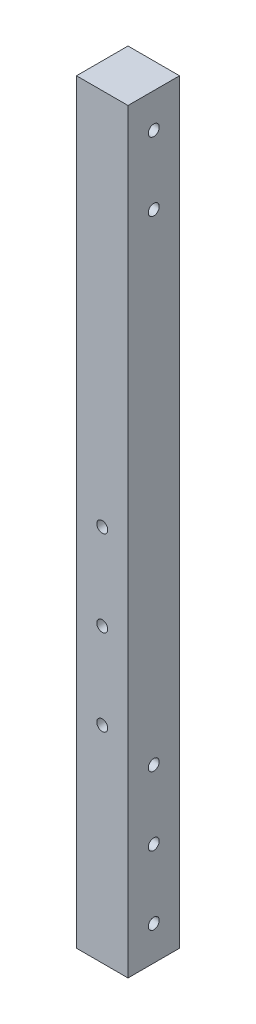
from build123d import *

# Parameters (mm, degrees)
SKETCH_1_W               = 15
SKETCH_1_H               = 15
EXTRUDE_1_DEPTH          = 220
SKETCH_2_R               = 1.6
CUT_EXTRUDE_1_DEPTH      = 222.020361053
CUT_EXTRUDE_2_DEPTH      = 222.020361053
CUT_EXTRUDE_2_DEPTH_BACK = 222.020361053
SKETCH_3_R               = 1.6


with BuildPart() as part:
    # 草图1 → 凸台-拉伸1 (new body)
    with BuildSketch(Plane(origin=(0, 0, 0), x_dir=(1, 0, 0), z_dir=(0, 1, 0))):
        with Locations((7.5, 7.5)):
            Rectangle(SKETCH_1_W, SKETCH_1_H)
    extrude(amount=EXTRUDE_1_DEPTH)

    # 草图2 → 切除-拉伸1 (cut, through all)
    with BuildSketch(Plane.XY):
        with Locations((7.5, 60)):
            Circle(SKETCH_2_R)
        with Locations((7.5, 85)):
            Circle(SKETCH_2_R)
        with Locations((7.5, 110)):
            Circle(SKETCH_2_R)
    extrude(amount=-CUT_EXTRUDE_1_DEPTH, mode=Mode.SUBTRACT)

    # 草图3 → 切除-拉伸2 (cut, two sides: drawn at the far end of the back side and taken through both)
    with BuildSketch(Plane.ZY.offset(-CUT_EXTRUDE_2_DEPTH_BACK)):
        with Locations((-7.5, 50)):
            Circle(SKETCH_3_R)
        with Locations((-7.5, 10)):
            Circle(SKETCH_3_R)
        with Locations((-7.5, 30)):
            Circle(SKETCH_3_R)
        with Locations((-7.5, 210)):
            Circle(SKETCH_3_R)
        with Locations((-7.5, 190)):
            Circle(SKETCH_3_R)
    extrude(amount=CUT_EXTRUDE_2_DEPTH + CUT_EXTRUDE_2_DEPTH_BACK, mode=Mode.SUBTRACT)


solid = part.part
